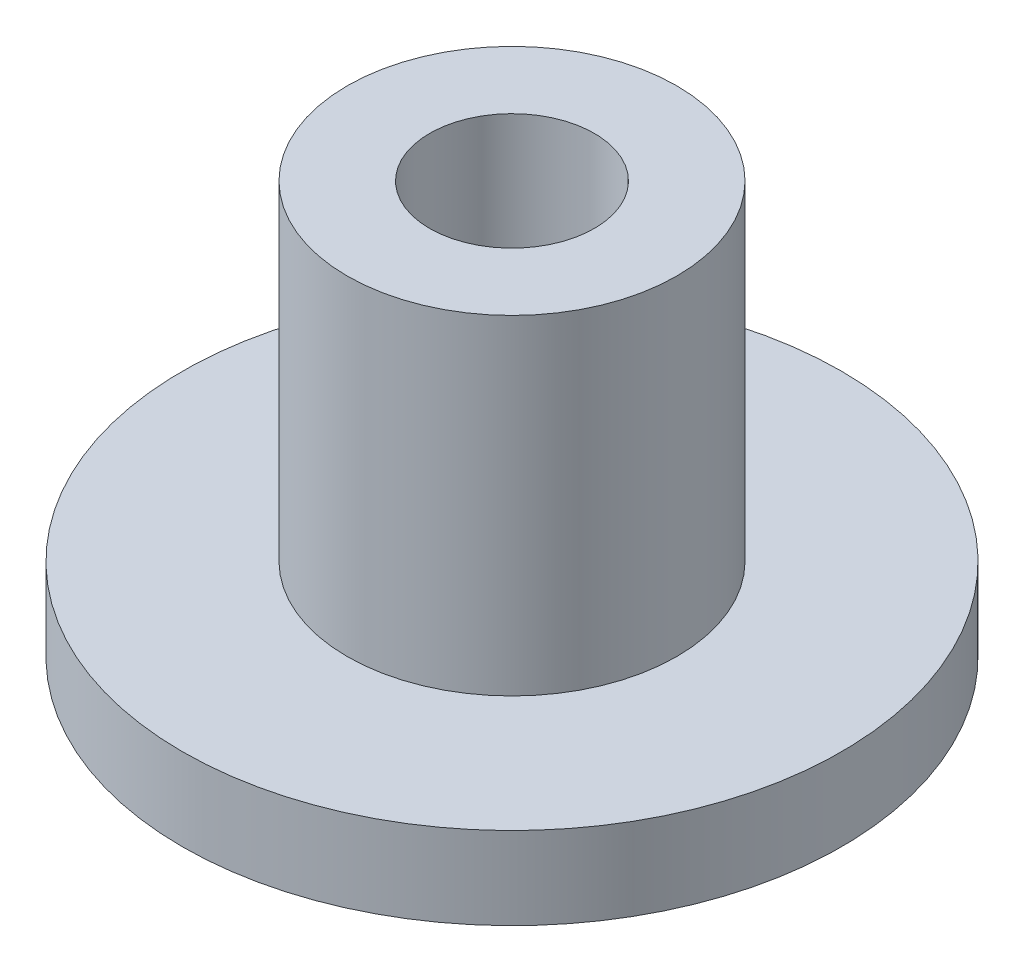
from build123d import *

# Parameters (mm, degrees)
SKETCH1_R           = 4
BOSS_EXTRUDE1_DEPTH = 1
SKETCH2_R           = 2
BOSS_EXTRUDE2_DEPTH = 4
SKETCH3_R           = 1
CUT_EXTRUDE1_DEPTH  = 8.549834435


with BuildPart() as part:
    # Sketch1 → Boss-Extrude1 (new body)
    with BuildSketch(Plane(origin=(0, 0, 0), x_dir=(1, 0, 0), z_dir=(0, 1, 0))):
        with Locations(Location((0, 0, 0), (0, 0, 270))):
            Circle(SKETCH1_R)
    extrude(amount=BOSS_EXTRUDE1_DEPTH)

    # Sketch2 → Boss-Extrude2 (add)
    with BuildSketch(Plane(origin=(0, 1, 0), x_dir=(1, 0, 0), z_dir=(0, 1, 0))):
        with Locations(Location((0, 0, 0), (0, 0, 270))):
            Circle(SKETCH2_R)
    extrude(amount=BOSS_EXTRUDE2_DEPTH)

    # Sketch3 → Cut-Extrude1 (cut, through all)
    with BuildSketch(Plane(origin=(0, 5, 0), x_dir=(1, 0, 0), z_dir=(0, 1, 0))):
        with Locations(Location((0, 0, 0), (0, 0, 270))):
            Circle(SKETCH3_R)
    extrude(amount=-CUT_EXTRUDE1_DEPTH, mode=Mode.SUBTRACT)


solid = part.part
